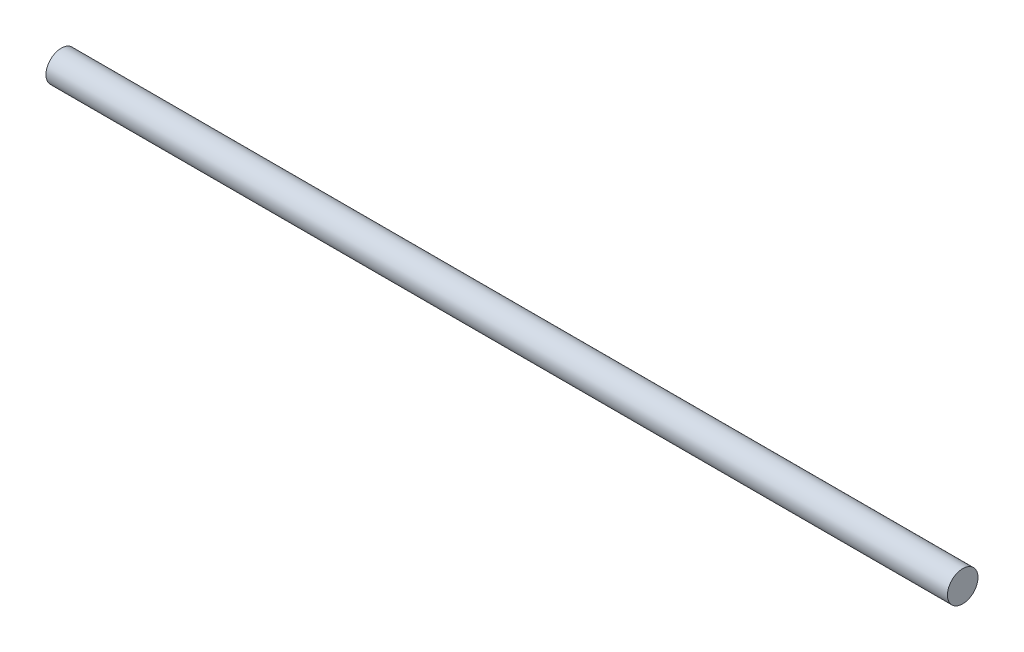
from build123d import *

# Parameters (mm, degrees)
SKETCH1_R           = 10
BOSS_EXTRUDE1_DEPTH = 590


with BuildPart() as part:
    # Sketch1 → Boss-Extrude1 (new body)
    with BuildSketch(Plane(origin=(0, 0, 0), x_dir=(0, 0, -1), z_dir=(1, 0, 0))):
        Circle(SKETCH1_R)
    extrude(amount=BOSS_EXTRUDE1_DEPTH)


solid = part.part
